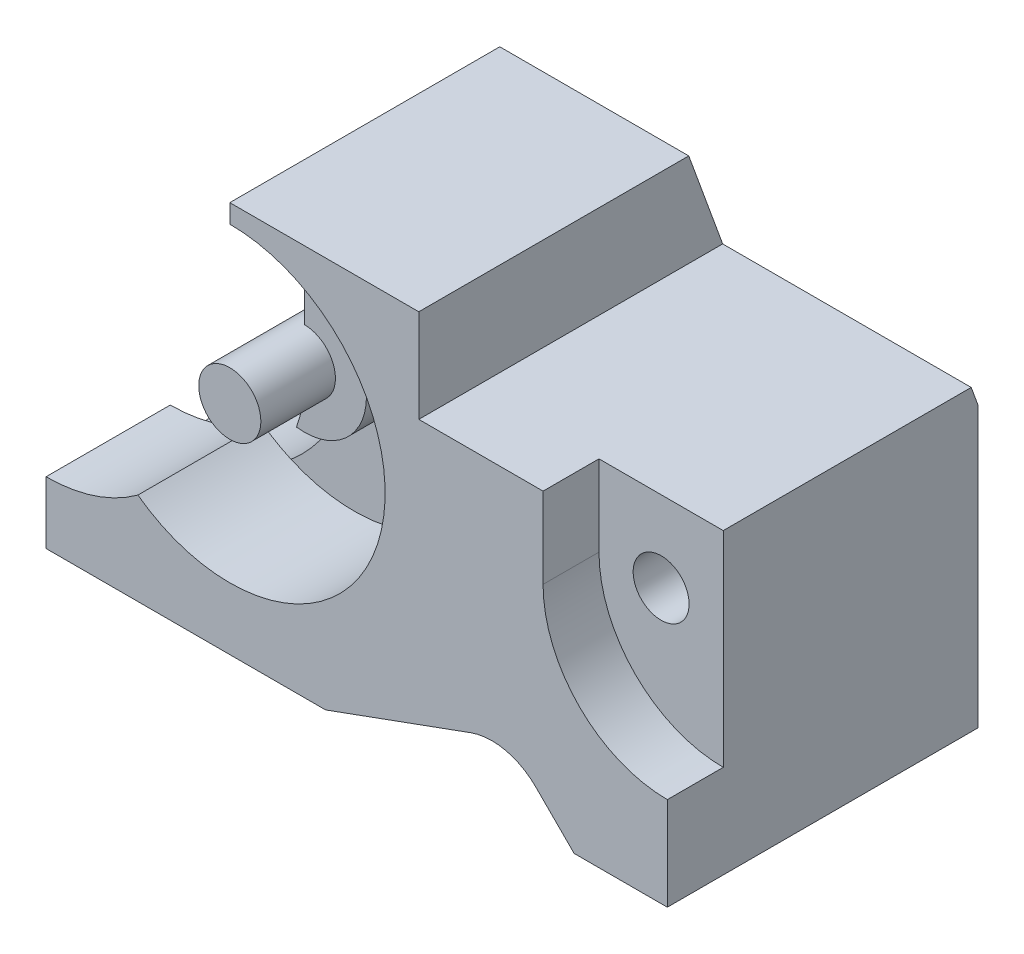
from build123d import *

# Parameters (mm, degrees)
BOSS_EXTRUDE1_DEPTH     = 50
SKETCH1_R               = 5
BOSS_EXTRUDE1_2_DEPTH   = 50
SKETCH1_5_R             = 4.5
BOSS_EXTRUDE2_DEPTH     = 41
BOSS_EXTRUDE3_DEPTH     = 30
BOSS_EXTRUDE4_DEPTH     = 38
CUT_EXTRUDE1_DEPTH      = 30
CUT_EXTRUDE2_DEPTH      = 101.344406919
CUT_EXTRUDE2_DEPTH_BACK = 101.344406919


with BuildPart() as part:
    # Sketch1 → Boss-Extrude1 (new body)
    with BuildSketch(Plane.XY):
        with BuildLine():
            Line((80, 48), (60, 48))
            Line((60, 48), (60, 63))
            Line((60, 63), (29.580398915, 63))
            Line((29.580398915, 63), (29.580398915, 60))
            ThreePointArc((29.580398915, 60), (53.338461855, 27.218326313), (14.790199458, 14.844355629))
            ThreePointArc((14.790199458, 14.844355629), (7.781673687, 11.241937061), (0, 10))
            Line((0, 10), (0, 0))
            Line((0, 0), (45, 0))
            Line((45, 0), (68.339650933, 8.494938218))
            ThreePointArc((68.339650933, 8.494938218), (73.924248506, 8.860972081), (78.830920178, 6.169079822))
            Line((78.830920178, 6.169079822), (85, 0))
            Line((85, 0), (100, 0))
            Line((100, 0), (100, 15))
            ThreePointArc((100, 15), (85.857864376, 20.857864376), (80, 35))
            Line((80, 35), (80, 48))
        make_face()
    extrude(amount=BOSS_EXTRUDE1_DEPTH)

    # Sketch1<5> → Boss-Extrude2 (add)
    with BuildSketch(Plane.XY):
        with BuildLine():
            Line((100, 48), (80, 48))
            Line((80, 48), (80, 35))
            ThreePointArc((80, 35), (85.857864376, 20.857864376), (100, 15))
            Line((100, 15), (100, 48))
        make_face()
        with Locations((90, 35)):
            Circle(SKETCH1_5_R, mode=Mode.SUBTRACT)
    extrude(amount=BOSS_EXTRUDE2_DEPTH)

    # Sketch1<6> → Boss-Extrude3 (add)
    with BuildSketch(Plane.XY):
        with BuildLine():
            ThreePointArc((19.438547859, 12.149554553), (54.037106954, 29.816426724), (29.580398915, 60))
            Line((29.580398915, 60), (29.580398915, 45))
            ThreePointArc((29.580398915, 45), (39.560207875, 34.364851879), (28.312667533, 25.080682627))
            ThreePointArc((28.312667533, 25.080682627), (24.735564703, 18.024964247), (19.438547859, 12.149554553))
        make_face()
    extrude(amount=BOSS_EXTRUDE3_DEPTH)



with BuildPart() as body_2:
    # Sketch1 → Boss-Extrude1 2 (new body)
    with BuildSketch(Plane.XY):
        with Locations((29.580398915, 35)):
            Circle(SKETCH1_R)
    extrude(amount=BOSS_EXTRUDE1_2_DEPTH)


with BuildPart() as part_1:
    add(part.part)

    add(body_2.part)  # Boss-Extrude4 merges body 2
    # Sketch1<7> → Boss-Extrude4 (add)
    with BuildSketch(Plane.XY):
        with BuildLine():
            ThreePointArc((28.312667533, 25.080682627), (39.560207875, 34.364851879), (29.580398915, 45))
            Line((29.580398915, 45), (29.580398915, 40))
            ThreePointArc((29.580398915, 40), (33.115932821, 38.535533906), (34.580398915, 35))
            ThreePointArc((34.580398915, 35), (33.115932821, 31.464466094), (29.580398915, 30))
            ThreePointArc((29.580398915, 30), (29.050846917, 27.513459181), (28.312667533, 25.080682627))
        make_face()
    extrude(amount=BOSS_EXTRUDE4_DEPTH)

    # Sketch4 → Cut-Extrude1 (cut)
    with BuildSketch(Plane.XY):
        with BuildLine():
            Line((0, 10), (0, 35))
            Line((0, 35), (24.580398915, 35))
            ThreePointArc((24.580398915, 35), (26.04486501, 31.464466094), (29.580398915, 30))
            ThreePointArc((29.580398915, 30), (19.364916731, 12.087121525), (0, 5))
            Line((0, 5), (0, 10))
        make_face()
    extrude(amount=CUT_EXTRUDE1_DEPTH, mode=Mode.SUBTRACT)

    # Sketch5 → Cut-Extrude2 (cut, two sides: drawn at the far end of the back side and taken through both)
    with BuildSketch(Plane(origin=(60, 0, 0), x_dir=(0, 0, -1), z_dir=(1, 0, 0)).offset(-CUT_EXTRUDE2_DEPTH_BACK)):
        Polygon((0, 45), (-6.551464217, 63), (0, 63), align=None)
    extrude(amount=CUT_EXTRUDE2_DEPTH + CUT_EXTRUDE2_DEPTH_BACK, mode=Mode.SUBTRACT)


solid = part_1.part
